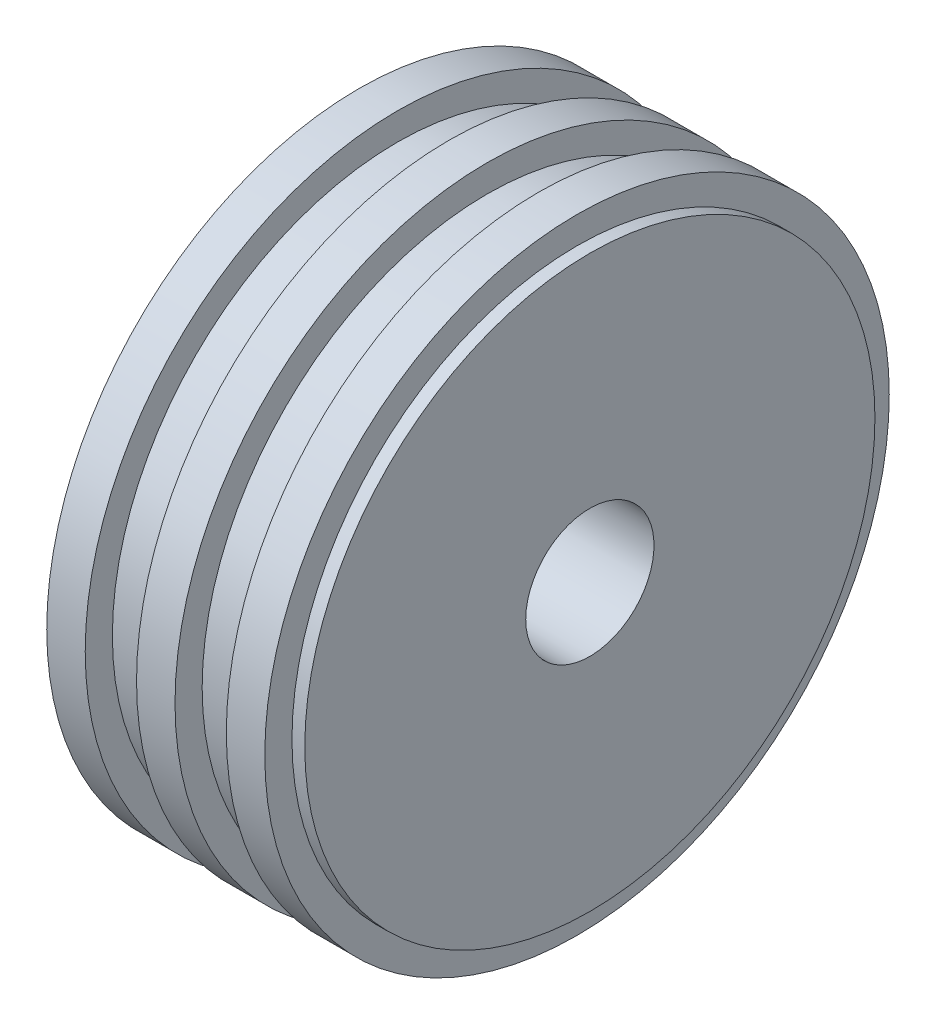
from build123d import *

# Parameters (mm, degrees)
SKETCH2_R          = 15
CUT_EXTRUDE1_DEPTH = 118.958896443


with BuildPart() as part:
    # Sketch1 → Revolve1 (revolve)
    with BuildSketch(Plane.XY, mode=Mode.PRIVATE) as revolve1_sk:
        Polygon((-28.5, 0), (-28.5, 66.675), (-25.5, 66.675), (-25.5, 73.025), (-16.5, 73.025), (-16.5, 66.675), (-4.5, 66.675), (-4.5, 73.025), (4.5, 73.025), (4.5, 66.675), (16.5, 66.675), (16.5, 73.025), (25.5, 73.025), (25.5, 66.675), (28.5, 66.675), (28.5, 0), align=None)
    revolve(revolve1_sk.sketch.rotate(Axis((0, 0, 0), (1, 0, 0)), 90), axis=Axis((0, 0, 0), (1, 0, 0)))

    # Sketch2 → Cut-Extrude1 (cut, through all)
    with BuildSketch(Plane.ZY.offset(28.5)):
        Circle(SKETCH2_R)
    extrude(amount=-CUT_EXTRUDE1_DEPTH, mode=Mode.SUBTRACT)


solid = part.part
